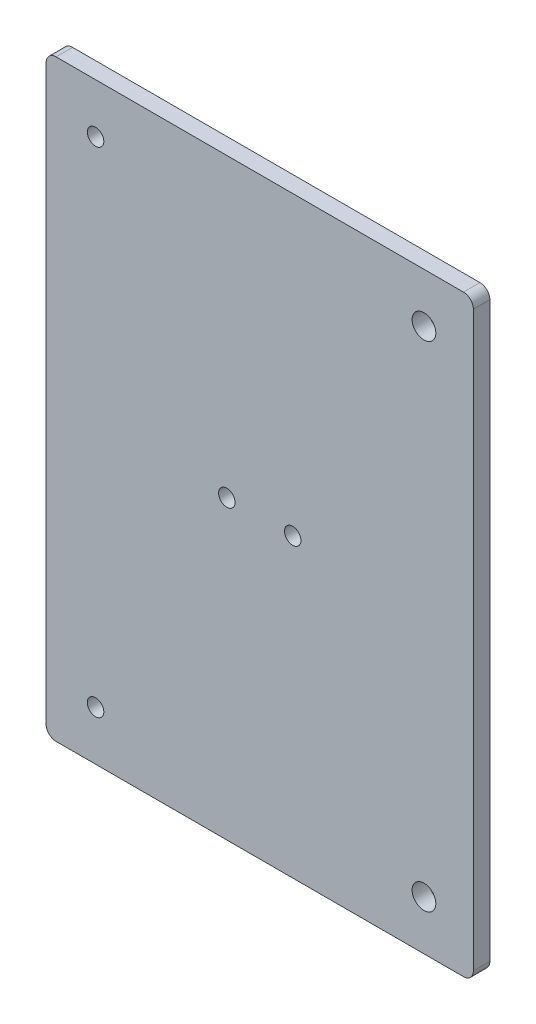
from build123d import *

# Parameters (mm, degrees)
SKETCH1_W           = 129.7
SKETCH1_H           = 180
SKETCH1_R           = 2.5
SKETCH1_R_2         = 3.6
BOSS_EXTRUDE1_DEPTH = 5
FILLET1_R           = 3


with BuildPart() as part:
    # Sketch1 → Boss-Extrude1 (new body)
    with BuildSketch(Plane.XY):
        with Locations((64.85, 90)):
            Rectangle(SKETCH1_W, SKETCH1_H)
        with Locations((15, 15)):
            Circle(SKETCH1_R, mode=Mode.SUBTRACT)
        with Locations((15, 165)):
            Circle(SKETCH1_R, mode=Mode.SUBTRACT)
        with Locations((114.7, 165)):
            Circle(SKETCH1_R_2, mode=Mode.SUBTRACT)
        with Locations((114.7, 15)):
            Circle(SKETCH1_R_2, mode=Mode.SUBTRACT)
        with Locations((74.85, 90)):
            Circle(SKETCH1_R, mode=Mode.SUBTRACT)
        with Locations((54.85, 90)):
            Circle(SKETCH1_R, mode=Mode.SUBTRACT)
    extrude(amount=BOSS_EXTRUDE1_DEPTH)

    # Fillet1
    fillet1_edges = [part.edges().sort_by_distance(p)[0] for p in [
        (0, 180, 2.5),
        (129.7, 180, 2.5),
        (129.7, 0, 2.5),
        (0, 0, 2.5),
    ]]
    fillet(fillet1_edges, radius=FILLET1_R)


solid = part.part
